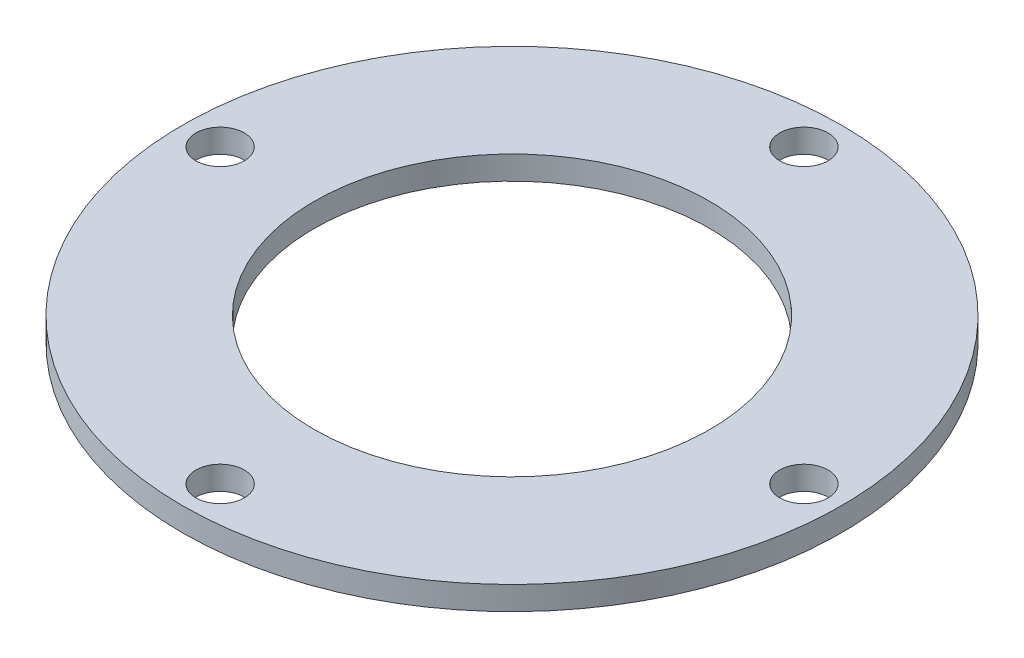
from build123d import *

# Parameters (mm, degrees)
SKETCH1_R           = 44.45
SKETCH1_R_2         = 26.67
SKETCH1_R_3         = 3.2639
BOSS_EXTRUDE1_DEPTH = 3.175


with BuildPart() as part:
    # Sketch1 → Boss-Extrude1 (new body)
    with BuildSketch(Plane(origin=(0, 0, 0), x_dir=(1, 0, 0), z_dir=(0, 1, 0))):
        with Locations(Location((0, 0, 0), (0, 0, 270))):
            Circle(SKETCH1_R)
        with Locations(Location((0, 0, 0), (0, 0, 270))):
            Circle(SKETCH1_R_2, mode=Mode.SUBTRACT)
        with Locations(Location((0, 39.37, 0), (0, 0, 270))):
            Circle(SKETCH1_R_3, mode=Mode.SUBTRACT)
        with Locations(Location((39.37, 0, 0), (0, 0, 270))):
            Circle(SKETCH1_R_3, mode=Mode.SUBTRACT)
        with Locations(Location((0, -39.37, 0), (0, 0, 270))):
            Circle(SKETCH1_R_3, mode=Mode.SUBTRACT)
        with Locations(Location((-39.37, 0, 0), (0, 0, 270))):
            Circle(SKETCH1_R_3, mode=Mode.SUBTRACT)
    extrude(amount=BOSS_EXTRUDE1_DEPTH)


solid = part.part
